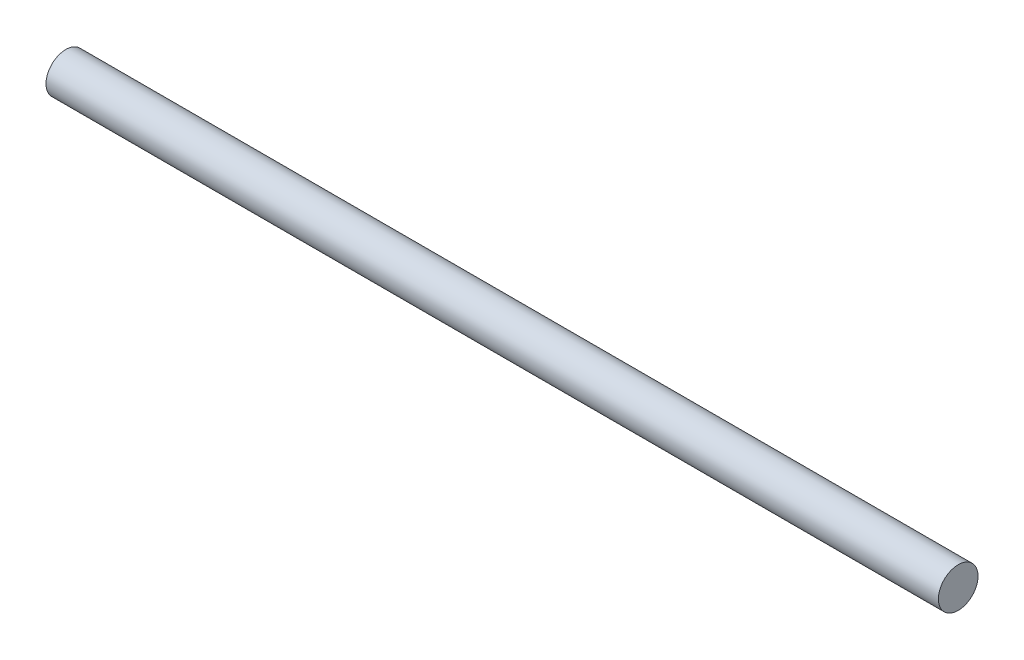
from build123d import *

# Parameters (mm, degrees)
SKETCH1_R           = 2
BOSS_EXTRUDE1_DEPTH = 90


with BuildPart() as part:
    # Sketch1 → Boss-Extrude1 (new body)
    with BuildSketch(Plane(origin=(0, 0, 0), x_dir=(0, 0, -1), z_dir=(1, 0, 0))):
        with Locations(Location((0, 0, 0), (0, 0, 180))):
            Circle(SKETCH1_R)
    extrude(amount=BOSS_EXTRUDE1_DEPTH)


solid = part.part
